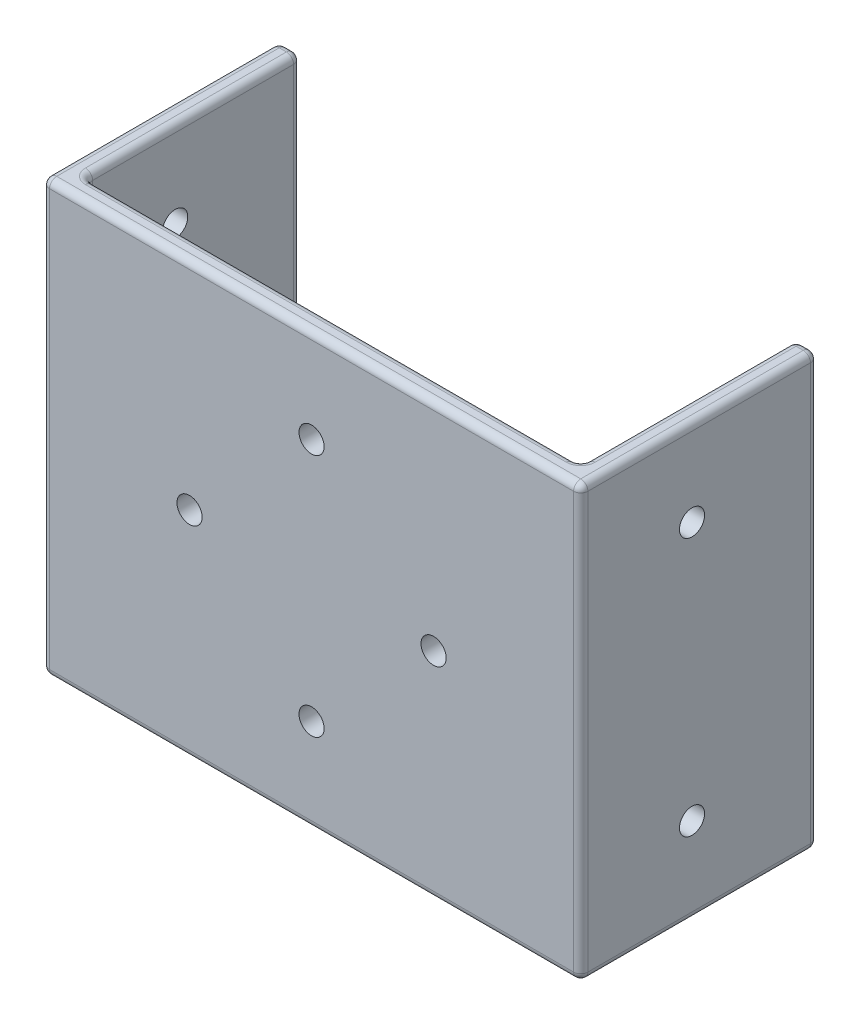
from build123d import *

# Parameters (mm, degrees)
SKETCH1_W           = 75
SKETCH1_H           = 60
BOSS_EXTRUDE1_DEPTH = 3
SKETCH2_W           = 3
SKETCH2_H           = 60
BOSS_EXTRUDE2_DEPTH = 30
SKETCH3_R           = 1.75
CUT_EXTRUDE1_DEPTH  = 30
FILLET1_R           = 1
SKETCH4_R           = 1.75
CUT_EXTRUDE2_DEPTH  = 87.168439698


with BuildPart() as part:
    # Sketch1 → Boss-Extrude1 (new body)
    with BuildSketch(Plane.XY):
        Rectangle(SKETCH1_W, SKETCH1_H)
    extrude(amount=BOSS_EXTRUDE1_DEPTH)

    # Sketch2 → Boss-Extrude2 (add)
    with BuildSketch(Plane(origin=(0, 0, 0), x_dir=(-1, 0, 0), z_dir=(0, 0, -1))):
        with Locations((-36, 0)):
            Rectangle(SKETCH2_W, SKETCH2_H)
    boss_extrude2 = extrude(amount=BOSS_EXTRUDE2_DEPTH)

    # Mirror1: Boss-Extrude2 across plane
    add(boss_extrude2.mirror(Plane(origin=(0, 0, 0), x_dir=(0, 0, 1), z_dir=(1, 0, 0))))

    # Sketch3 → Cut-Extrude1 (cut)
    with BuildSketch(Plane.XY.offset(3)):
        with Locations((0, 17)):
            Circle(SKETCH3_R)
        with Locations((17, 0)):
            Circle(SKETCH3_R)
        with Locations((0, -17)):
            Circle(SKETCH3_R)
        with Locations((-17, 0)):
            Circle(SKETCH3_R)
    extrude(amount=-CUT_EXTRUDE1_DEPTH, mode=Mode.SUBTRACT)

    # Fillet1
    fillet1_edges = [part.edges().sort_by_distance(p)[0] for p in [
        (-37.5, 0, 3),
        (0, 30, 0),
        (34.5, 0, 0),
        (34.5, -30, -15),
        (34.5, 30, -15),
        (37.5, 0, -30),
        (0, -30, 3),
        (36, -30, -30),
        (34.5, 0, -30),
        (36, 30, -30),
        (0, -30, 0),
        (-37.5, 0, -30),
        (-36, 30, -30),
        (-34.5, 0, -30),
        (-34.5, 30, -15),
        (-36, -30, -30),
        (-34.5, -30, -15),
        (-34.5, 0, 0),
        (37.5, 0, 3),
        (37.5, -30, -13.5),
        (-37.5, -30, -13.5),
        (-37.5, 30, -13.5),
        (37.5, 30, -13.5),
        (0, 30, 3),
    ]]
    fillet(fillet1_edges, radius=FILLET1_R)

    # Sketch4 → Cut-Extrude2 (cut, through all)
    with BuildSketch(Plane(origin=(37.5, 0, 0), x_dir=(0, 0, -1), z_dir=(1, 0, 0))):
        with Locations((12.5, 18)):
            Circle(SKETCH4_R)
        with Locations((12.5, -18)):
            Circle(SKETCH4_R)
    extrude(amount=-CUT_EXTRUDE2_DEPTH, mode=Mode.SUBTRACT)


solid = part.part
